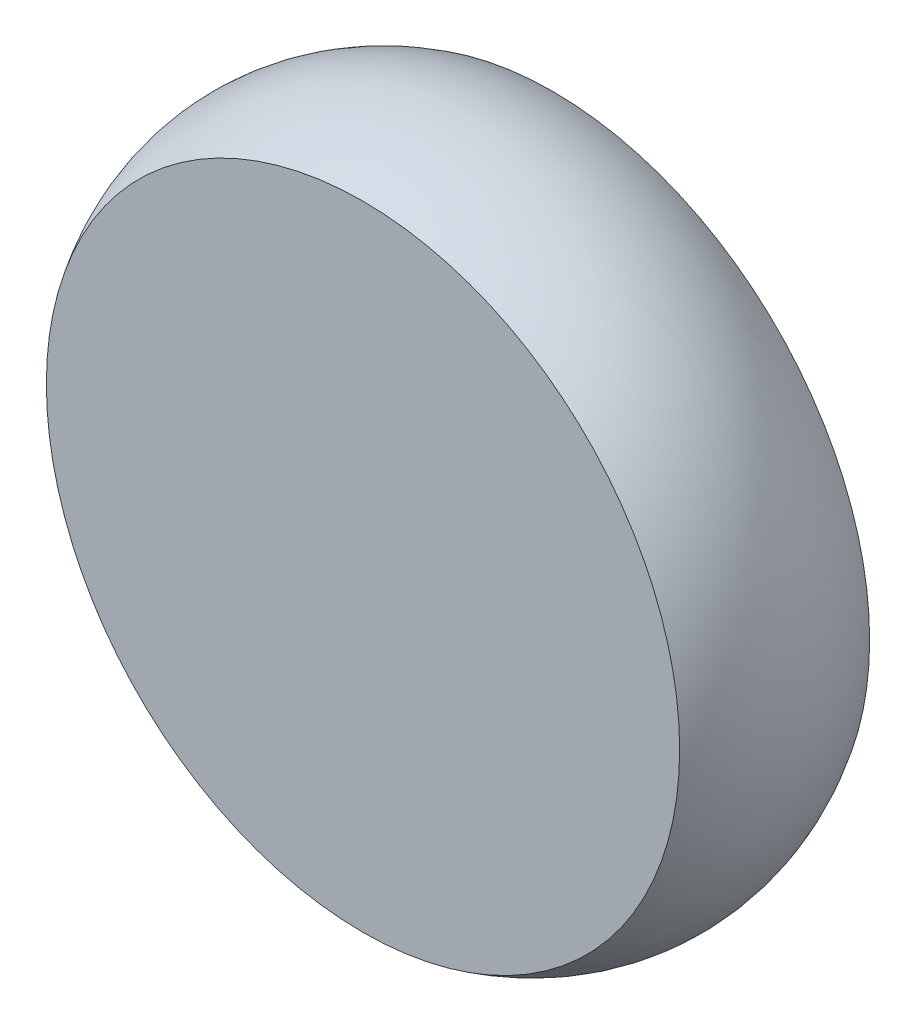
from build123d import *

# Parameters (mm, degrees)
SKETCH2_R           = 50
BOSS_EXTRUDE1_DEPTH = 100
SKETCH3_R           = 30
BOSS_EXTRUDE2_DEPTH = 50
SKETCH4_R           = 20
CUT_EXTRUDE1_DEPTH  = 30


with BuildPart() as part:
    # Sketch1 → Revolve1 (revolve)
    with BuildSketch(Plane(origin=(0, 0, 0), x_dir=(0, 0, -1), z_dir=(1, 0, 0)), mode=Mode.PRIVATE) as revolve1_sk:
        with BuildLine():
            Line((0, 0), (0, 10))
            Line((0, 10), (0, 250))
            Line((0, 250), (6, 250))
            Line((6, 250), (6, 10))
            Line((6, 10), (150, 10))
            Line((150, 10), (150, 0))
            ThreePointArc((150, 0), (75, -21.784095825), (0, 0))
        make_face()
    revolve(revolve1_sk.sketch.rotate(Axis((0, 250, 0), (0, 0, -1)), 270), axis=Axis((0, 250, 0), (0, 0, -1)))

    # Sketch2 → Boss-Extrude1 (add)
    with BuildSketch(Plane(origin=(0, 0, -6), x_dir=(-1, 0, 0), z_dir=(0, 0, -1))):
        with Locations((0, 250)):
            Circle(SKETCH2_R)
    extrude(amount=BOSS_EXTRUDE1_DEPTH)

    # Sketch3 → Boss-Extrude2 (add)
    with BuildSketch(Plane(origin=(0, 0, -106), x_dir=(-1, 0, 0), z_dir=(0, 0, -1))):
        with Locations((0, 250)):
            Circle(SKETCH3_R)
    extrude(amount=BOSS_EXTRUDE2_DEPTH)

    # Sketch4 → Cut-Extrude1 (cut)
    with BuildSketch(Plane(origin=(0, 0, -156), x_dir=(-1, 0, 0), z_dir=(0, 0, -1))):
        with Locations((0, 250)):
            Circle(SKETCH4_R)
    extrude(amount=-CUT_EXTRUDE1_DEPTH, mode=Mode.SUBTRACT)


solid = part.part
